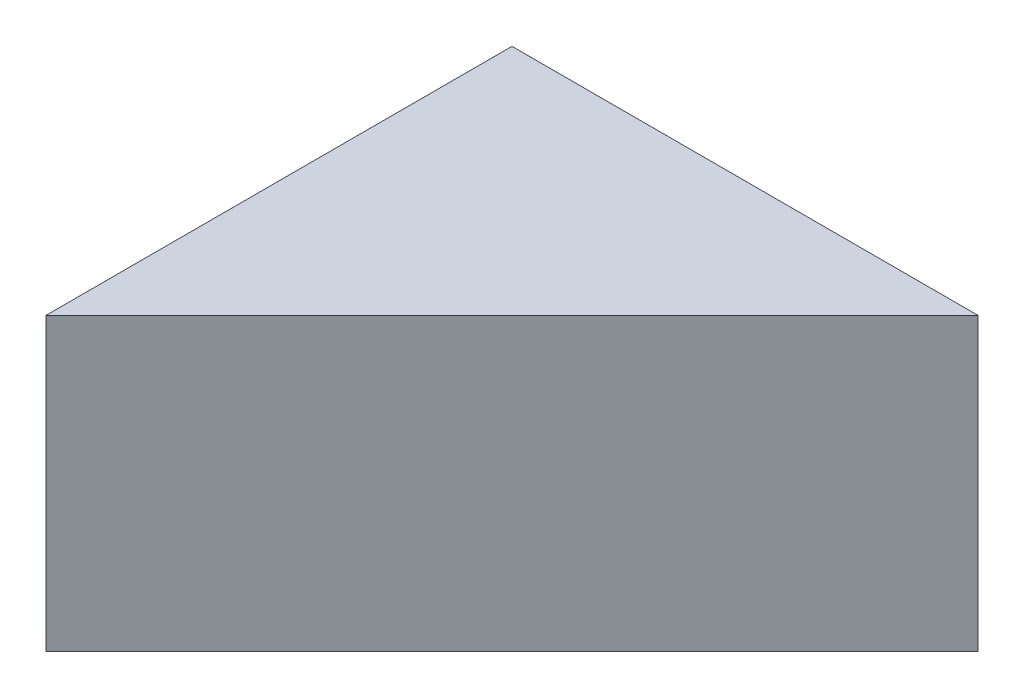
from build123d import *

# Parameters (mm, degrees)
BOSS_EXTRUDE1_DEPTH = 10


with BuildPart() as part:
    # Sketch1 → Boss-Extrude1 (new body)
    with BuildSketch(Plane(origin=(0, 0, 0), x_dir=(1, 0, 0), z_dir=(0, 1, 0))):
        Polygon((0, -8), (0, 8), (16, 8), align=None)
    extrude(amount=BOSS_EXTRUDE1_DEPTH)


solid = part.part
